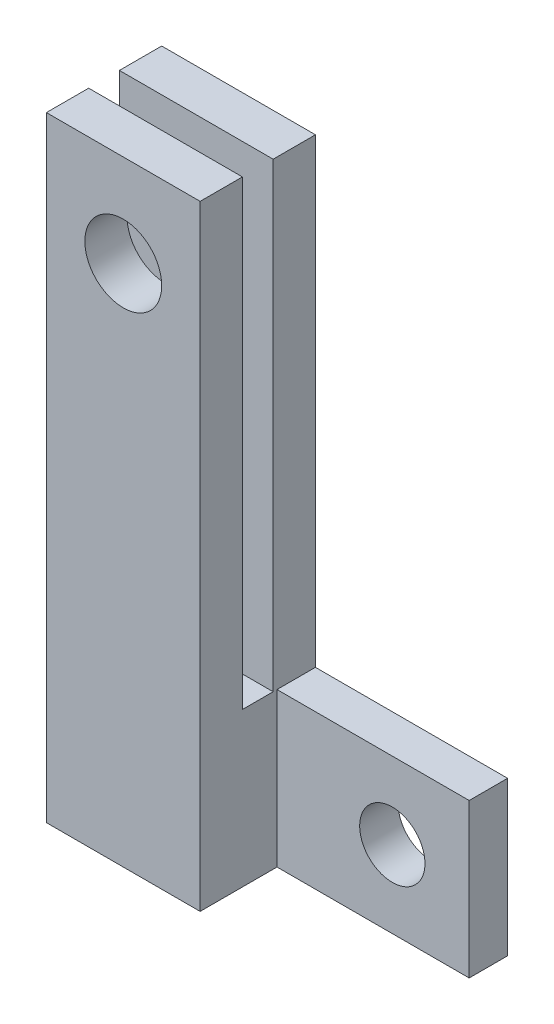
from build123d import *

# Parameters (mm, degrees)
SKETCH1_W           = 20
SKETCH1_H           = 70
BOSS_EXTRUDE1_DEPTH = 15
SKETCH2_W           = 20
SKETCH2_H           = 4
CUT_EXTRUDE1_DEPTH  = 60
SKETCH3_R           = 5
CUT_EXTRUDE2_DEPTH  = 15
SKETCH4_W           = 45
SKETCH4_H           = 20
BOSS_EXTRUDE2_DEPTH = 5
SKETCH7_R           = 4.25
CUT_EXTRUDE4_DEPTH  = 8
SKETCH8_W           = 20
SKETCH8_H           = 10
BOSS_EXTRUDE3_DEPTH = 10
SKETCH9_W           = 5
SKETCH9_H           = 12
CUT_EXTRUDE5_DEPTH  = 10
SKETCH10_W          = 12
SKETCH10_H          = 16
BOSS_EXTRUDE4_DEPTH = 1


with BuildPart() as part:
    # Sketch1 → Boss-Extrude1 (new body)
    with BuildSketch(Plane.XY):
        with Locations((0, -4.140597693)):
            Rectangle(SKETCH1_W, SKETCH1_H)
    extrude(amount=BOSS_EXTRUDE1_DEPTH)

    # Sketch2 → Cut-Extrude1 (cut)
    with BuildSketch(Plane(origin=(0, 30.859402307, 0), x_dir=(1, 0, 0), z_dir=(0, 1, 0))):
        with Locations((0, -7.5)):
            Rectangle(SKETCH2_W, SKETCH2_H)
    extrude(amount=-CUT_EXTRUDE1_DEPTH, mode=Mode.SUBTRACT)

    # Sketch3 → Cut-Extrude2 (cut)
    with BuildSketch(Plane.XY.offset(15)):
        with Locations((0, 18.859402307)):
            Circle(SKETCH3_R)
    extrude(amount=-CUT_EXTRUDE2_DEPTH, mode=Mode.SUBTRACT)

    # Sketch4 → Boss-Extrude2 (add)
    with BuildSketch(Plane(origin=(0, 0, 0), x_dir=(-1, 0, 0), z_dir=(0, 0, -1))):
        with Locations((-12.5, -39.140597693)):
            Rectangle(SKETCH4_W, SKETCH4_H)
    extrude(amount=-BOSS_EXTRUDE2_DEPTH)

    # Sketch7 → Cut-Extrude4 (cut)
    with BuildSketch(Plane(origin=(0, 0, 0), x_dir=(-1, 0, 0), z_dir=(0, 0, -1))):
        with Locations((-25, -39.122753145)):
            Circle(SKETCH7_R)
    extrude(amount=-CUT_EXTRUDE4_DEPTH, mode=Mode.SUBTRACT)

    # Sketch8 → Boss-Extrude3 (add)
    with BuildSketch(Plane.XY.offset(5)):
        with Locations((0, -44.140597693)):
            Rectangle(SKETCH8_W, SKETCH8_H)
    extrude(amount=BOSS_EXTRUDE3_DEPTH)

    # Sketch9 → Cut-Extrude5 (cut)
    with BuildSketch(Plane(origin=(0, 0, 0), x_dir=(-1, 0, 0), z_dir=(0, 0, -1))):
        with Locations((7.5, -39.122753145)):
            Rectangle(SKETCH9_W, SKETCH9_H)
    extrude(amount=-CUT_EXTRUDE5_DEPTH, mode=Mode.SUBTRACT)

    # Sketch10 → Boss-Extrude4 (add)
    with BuildSketch(Plane.ZY.offset(10)):
        with Locations((6, -39.122753145)):
            Rectangle(SKETCH10_W, SKETCH10_H)
    extrude(amount=BOSS_EXTRUDE4_DEPTH)


solid = part.part
